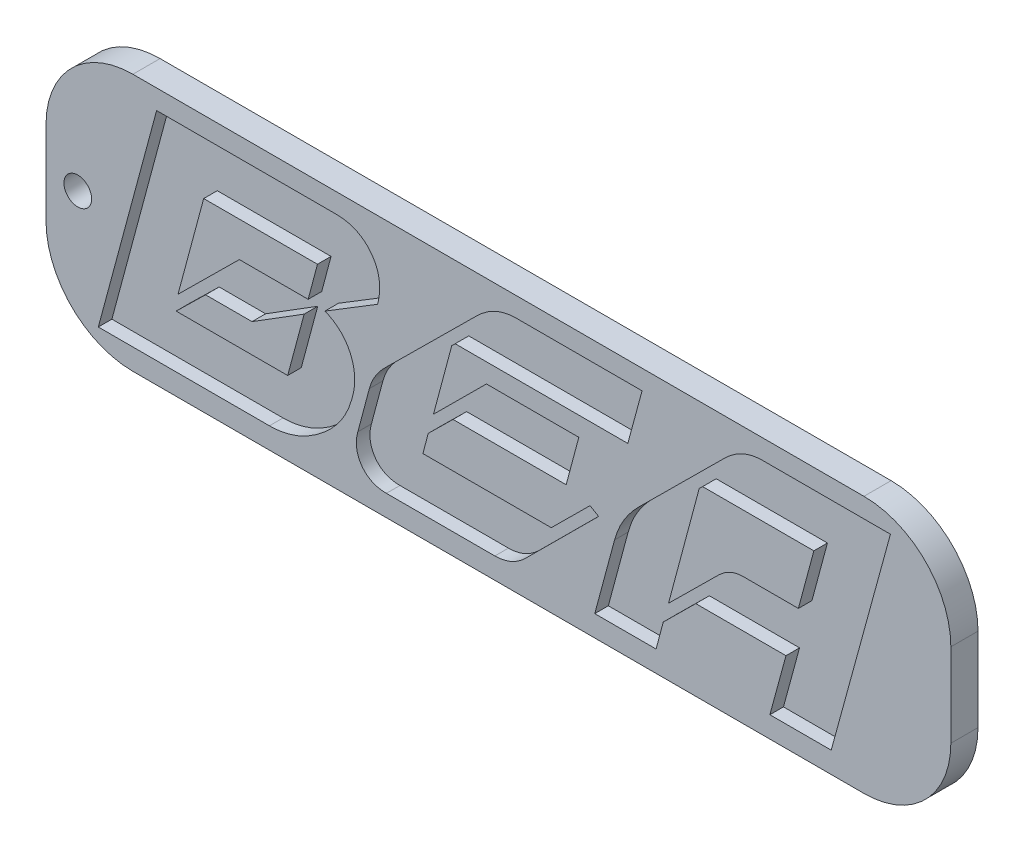
from build123d import *

# Parameters (mm, degrees)
SKETCH1_R           = 1.617686351
BOSS_EXTRUDE1_DEPTH = 3.175
CUT_EXTRUDE1_DEPTH  = 1.5875


with BuildPart() as part:
    # Sketch1 → Boss-Extrude1 (new body)
    with BuildSketch(Plane.XY):
        with BuildLine():
            Line((2.376512113, 27.65079512), (87.842998078, 27.65079512))
            ThreePointArc((87.842998078, 27.65079512), (95.027202975, 24.675000017), (98.002998078, 17.49079512))
            Line((98.002998078, 17.49079512), (98.002998078, 7.726780525))
            ThreePointArc((98.002998078, 7.726780525), (95.027202975, 0.542575628), (87.842998078, -2.433219475))
            Line((87.842998078, -2.433219475), (2.376512113, -2.433219475))
            ThreePointArc((2.376512113, -2.433219475), (-4.807692784, 0.542575628), (-7.783487887, 7.726780525))
            Line((-7.783487887, 7.726780525), (-7.783487887, 17.49079512))
            ThreePointArc((-7.783487887, 17.49079512), (-4.807692784, 24.675000017), (2.376512113, 27.65079512))
        make_face()
        with Locations((-4.068268159, 12.608787822)):
            Circle(SKETCH1_R, mode=Mode.SUBTRACT)
    extrude(amount=BOSS_EXTRUDE1_DEPTH)

    # Sketch2 → Cut-Extrude1 (cut)
    # profile 1 of 3: a face of its own
    with BuildSketch(Plane.XY.offset(3.175)):
        with BuildLine():
            add(Edge.make_bspline(
                [(26.055314757, 25.363302374), (26.281041178, 25.357148606), (26.720344033, 25.345172305), (27.358603179, 25.255576736), (27.954181106, 25.10565776), (28.506593472, 24.887414053), (29.01635882, 24.61026015), (29.483989025, 24.268912351), (29.909556765, 23.870244327), (30.286214231, 23.412653315), (30.607890769, 22.914633219), (30.869796512, 22.384371241), (31.05896534, 21.825349006), (31.177064683, 21.240476881), (31.238829311, 20.630578255), (31.216595671, 19.996303633), (31.140690223, 19.333888525), (31.036825384, 18.891448023), (30.983281734, 18.663364293)],
                knots=[0, 0, 0, 0, 1.104647112, 2.14983532, 3.14775057, 4.103991838, 5.04949864, 5.980264506, 6.930364641, 7.896350518, 8.873894228, 9.826455567, 10.784034957, 11.753687545, 12.741876869, 13.777217861, 14.854127416, 16, 16, 16, 16], degree=3))
            Line((30.983281734, 18.663364293), (24.823323013, 14.893993808))
            add(Edge.make_bspline(
                [(24.823323013, 14.893993808), (24.913627964, 14.852436986), (25.056727556, 14.786584956), (25.204086092, 14.731009487), (25.258452012, 14.710505676)],
                knots=[0, 0, 0, 0, 1.262127295, 2, 2, 2, 2], degree=3))
            add(Edge.make_bspline(
                [(25.258452012, 14.710505676), (25.408658011, 14.633015541), (25.70455598, 14.480364025), (26.115294044, 14.203511612), (26.494533839, 13.898795938), (26.842207753, 13.563435468), (27.152694985, 13.192982522), (27.431219321, 12.792771569), (27.67927879, 12.362334709), (27.886089668, 11.901078686), (28.060682724, 11.422012006), (28.186061, 10.924600148), (28.269482345, 10.415995768), (28.312768514, 9.893514579), (28.306836135, 9.356553203), (28.251637963, 8.806740636), (28.160254496, 8.243184587), (28.061167889, 7.870056205), (28.010773994, 7.680288958)],
                knots=[0, 0, 0, 0, 0.984435104, 1.939285714, 2.881007598, 3.817426453, 4.749903878, 5.693661681, 6.656357472, 7.640950646, 8.636494269, 9.624663586, 10.626026113, 11.637696297, 12.67668649, 13.751023199, 14.856205644, 16, 16, 16, 16], degree=3))
            add(Edge.make_bspline(
                [(28.010773994, 7.680288958), (27.934336699, 7.418635325), (27.781985703, 6.897120378), (27.483880814, 6.140182715), (27.111873403, 5.418274722), (26.680602198, 4.723985098), (26.188457087, 4.059016869), (25.632410614, 3.42464569), (25.013362966, 2.8218799), (24.336555177, 2.259555831), (23.632617641, 1.73501911), (22.90194296, 1.286167719), (22.165575056, 0.899844078), (21.419750266, 0.582322921), (20.662474561, 0.341850589), (19.896429331, 0.167011128), (19.120780451, 0.059173369), (18.599040207, 0.044186513), (18.338328173, 0.036697626)],
                knots=[0, 0, 0, 0, 0.992207688, 1.977618791, 2.956517026, 3.945270844, 4.9506118, 5.965172583, 7.01356654, 8.093011568, 9.167098768, 10.207118156, 11.211733991, 12.192594754, 13.154449955, 14.10064625, 15.050898635, 16, 16, 16, 16], degree=3))
            Line((18.338328173, 0.036697626), (-1.667120743, 0.036697626))
            Line((-1.667120743, 0.036697626), (5.148152735, 25.363302374))
            Line((5.148152735, 25.363302374), (26.055314757, 25.363302374))
        make_face()
        Polygon((20.472033024, 6.196656347), (22.396037152, 13.373663571), (16.304231166, 9.567595459), (10.872982456, 9.567595459), (7.428648091, 6.196656347), align=None, mode=Mode.SUBTRACT)
        Polygon((22.867863777, 15.108937049), (23.953065015, 19.203343653), (10.652796698, 19.203343653), (7.648833849, 8.010567595), (14.820598555, 15.108937049), align=None, mode=Mode.SUBTRACT)
    # profile 2 of 3: a face of its own
    with BuildSketch(Plane.XY.offset(3.175)):
        with BuildLine():
            Line((40.052837977, 19.203343653), (39.654406605, 18.804912281))
            Line((39.654406605, 18.804912281), (37.515459236, 10.799587203))
            Line((37.515459236, 10.799587203), (43.712115583, 16.959545924))
            Line((43.712115583, 16.959545924), (54.511702786, 16.959545924))
            Line((54.511702786, 16.959545924), (53.028070175, 11.412961816))
            Line((53.028070175, 11.412961816), (39.80119711, 11.412961816))
            Line((39.80119711, 11.412961816), (36.902084623, 8.550546956))
            Line((36.902084623, 8.550546956), (36.283467492, 6.196656347))
            Line((36.283467492, 6.196656347), (51.28755418, 6.196656347))
            Line((51.28755418, 6.196656347), (55.817089783, 10.689494324))
            Line((55.817089783, 10.689494324), (56.828895769, 10.107574819))
            Line((56.828895769, 10.107574819), (48.278348813, 1.59372549))
            add(Edge.make_bspline(
                [(48.278348813, 1.59372549), (48.146238635, 1.46854593), (47.88717571, 1.223073677), (47.463918948, 0.909946193), (47.033190065, 0.640669228), (46.59089137, 0.416443393), (46.132411822, 0.249897844), (45.663767632, 0.128735888), (45.18249618, 0.052398669), (44.857011314, 0.041969808), (44.69246646, 0.036697626)],
                knots=[0, 0, 0, 0, 1.087710149, 2.132957327, 3.142311131, 4.123953504, 5.092881289, 6.053713067, 7.016078678, 8, 8, 8, 8], degree=3))
            Line((44.69246646, 0.036697626), (32.010815273, 0.036697626))
            add(Edge.make_bspline(
                [(32.010815273, 0.036697626), (31.858553331, 0.040498566), (31.561404624, 0.047916336), (31.12901049, 0.112299235), (30.724143119, 0.215813593), (30.34795697, 0.362171558), (30.00473747, 0.556447691), (29.68026271, 0.779177165), (29.39172657, 1.055755752), (29.136150439, 1.370039707), (28.916823334, 1.712741424), (28.744197554, 2.078286326), (28.60860469, 2.456433819), (28.533199597, 2.856014145), (28.494863315, 3.270534693), (28.507441143, 3.702944694), (28.564324089, 4.151146712), (28.63851974, 4.4497704), (28.676573787, 4.602930857)],
                knots=[0, 0, 0, 0, 1.094945795, 2.136855229, 3.137044923, 4.096584279, 5.030749513, 5.969051044, 6.920650617, 7.894578144, 8.878114772, 9.839711021, 10.797931648, 11.759527897, 12.756631189, 13.787866602, 14.865423694, 16, 16, 16, 16], degree=3))
            Line((28.676573787, 4.602930857), (30.018658411, 9.640990712))
            add(Edge.make_bspline(
                [(30.018658411, 9.640990712), (30.105903319, 9.92074967), (30.280853255, 10.481743003), (30.707081382, 11.263251403), (31.216779073, 12.016946207), (31.645281289, 12.457007159), (31.864024768, 12.681651187)],
                knots=[0, 0, 0, 0, 0.975136166, 1.955415087, 2.956272335, 4, 4, 4, 4], degree=3))
            Line((31.864024768, 12.681651187), (42.553519092, 23.26629515))
            add(Edge.make_bspline(
                [(42.553519092, 23.26629515), (42.728913539, 23.433821304), (43.070994593, 23.760556411), (43.621916797, 24.186341546), (44.183374604, 24.554272478), (44.766535305, 24.843767238), (45.358833813, 25.082449973), (45.970393028, 25.241335998), (46.595330871, 25.346832444), (47.017966502, 25.357802691), (47.229845201, 25.363302374)],
                knots=[0, 0, 0, 0, 1.104987577, 2.155115633, 3.169368792, 4.159784375, 5.118388166, 6.074904324, 7.034897349, 8, 8, 8, 8], degree=3))
            Line((47.229845201, 25.363302374), (61.903653251, 25.363302374))
            Line((61.903653251, 25.363302374), (60.236532508, 19.203343653))
            Line((60.236532508, 19.203343653), (40.052837977, 19.203343653))
        make_face()
    # profile 3 of 3: a face of its own
    with BuildSketch(Plane.XY.offset(3.175)):
        with BuildLine():
            Line((76.01126935, 25.363302374), (90.941960784, 25.363302374))
            Line((90.941960784, 25.363302374), (84.016594427, 0.036697626))
            Line((84.016594427, 0.036697626), (76.844829721, 0.036697626))
            Line((76.844829721, 0.036697626), (78.726893705, 6.956821465))
            Line((78.726893705, 6.956821465), (68.184189886, 6.956821465))
            Line((68.184189886, 6.956821465), (64.378121775, 3.18745098))
            Line((64.378121775, 3.18745098), (63.544561404, 0.036697626))
            Line((63.544561404, 0.036697626), (56.372796698, 0.036697626))
            Line((56.372796698, 0.036697626), (58.68998968, 8.660639835))
            add(Edge.make_bspline(
                [(58.68998968, 8.660639835), (58.755206826, 8.881790357), (58.885530435, 9.32371608), (59.134167271, 9.97030979), (59.42672045, 10.600153997), (59.771647631, 11.211465097), (60.158176901, 11.807063633), (60.588878909, 12.38650539), (61.069376559, 12.943271893), (61.414284452, 13.298477026), (61.589102167, 13.478513932)],
                knots=[0, 0, 0, 0, 0.972188851, 1.942727767, 2.918792729, 3.89888478, 4.900660299, 5.911935627, 6.941657613, 8, 8, 8, 8], degree=3))
            Line((61.589102167, 13.478513932), (71.591826625, 23.407843137))
            add(Edge.make_bspline(
                [(71.591826625, 23.407843137), (71.757107834, 23.56270533), (72.081611644, 23.866753032), (72.601980127, 24.266531398), (73.138947216, 24.602237151), (73.684800305, 24.883050108), (74.246444332, 25.101729813), (74.823529255, 25.252414119), (75.414191387, 25.344058862), (75.811733587, 25.35687144), (76.01126935, 25.363302374)],
                knots=[0, 0, 0, 0, 1.09520327, 2.15026038, 3.168190723, 4.15492977, 5.115689715, 6.0773418, 7.034972711, 8, 8, 8, 8], degree=3))
        make_face()
        with BuildLine():
            Line((80.179071207, 12.466707946), (81.987739938, 19.203343653))
            Line((81.987739938, 19.203343653), (68.981052632, 19.203343653))
            Line((68.981052632, 19.203343653), (68.582621259, 18.804912281))
            Line((68.582621259, 18.804912281), (64.996738906, 5.399793602))
            Line((64.996738906, 5.399793602), (70.826418989, 11.161320949))
            add(Edge.make_bspline(
                [(70.826418989, 11.161320949), (70.934905254, 11.264494776), (71.148060273, 11.467211858), (71.489484319, 11.734822191), (71.842666884, 11.964098761), (72.208262313, 12.144359196), (72.580718442, 12.291666427), (72.965176253, 12.387949636), (73.359703622, 12.455328131), (73.6273836, 12.462895723), (73.762229102, 12.466707946)],
                knots=[0, 0, 0, 0, 1.088018936, 2.137751703, 3.149265309, 4.143636785, 5.096896491, 6.055307392, 7.020348651, 8, 8, 8, 8], degree=3))
            Line((73.762229102, 12.466707946), (80.179071207, 12.466707946))
        make_face(mode=Mode.SUBTRACT)
    extrude(amount=-CUT_EXTRUDE1_DEPTH, mode=Mode.SUBTRACT)


solid = part.part
